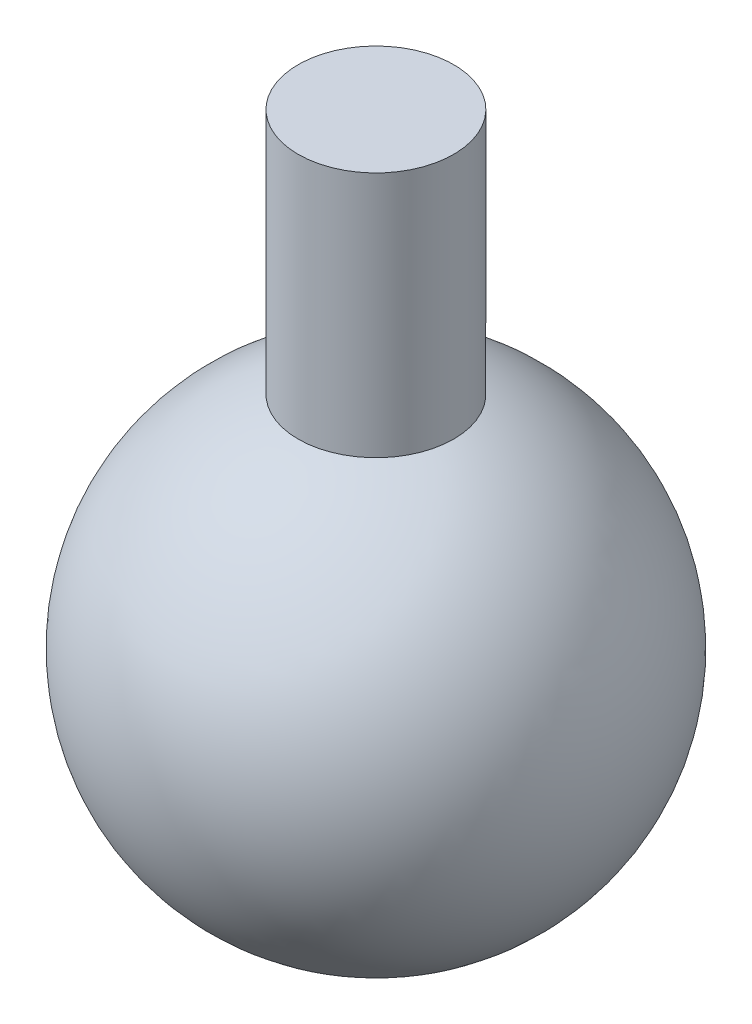
from build123d import *

# Parameters (mm, degrees)
BOSS_EXTRUDE1_DEPTH      = 75
BOSS_EXTRUDE1_DEPTH_BACK = 10
SKETCH2_R                = 25


with BuildPart() as part:
    # Sketch1 → Revolve1 (revolve)
    with BuildSketch(Plane.XY):
        with BuildLine():
            Line((0, 75), (0, -75))
            ThreePointArc((0, -75), (75, 0), (0, 75))
        make_face()
    revolve(axis=Axis((0, 75, 0), (0, -1, 0)))

    # Sketch2 → Boss-Extrude1 (add, two sides: drawn at the far end of the back side and taken through both)
    with BuildSketch(Plane(origin=(0, 75, 0), x_dir=(1, 0, 0), z_dir=(0, 1, 0)).offset(-BOSS_EXTRUDE1_DEPTH_BACK)):
        with Locations(Location((0, 0, 0), (0, 0, 270))):
            Circle(SKETCH2_R)
    extrude(amount=BOSS_EXTRUDE1_DEPTH + BOSS_EXTRUDE1_DEPTH_BACK)


solid = part.part
